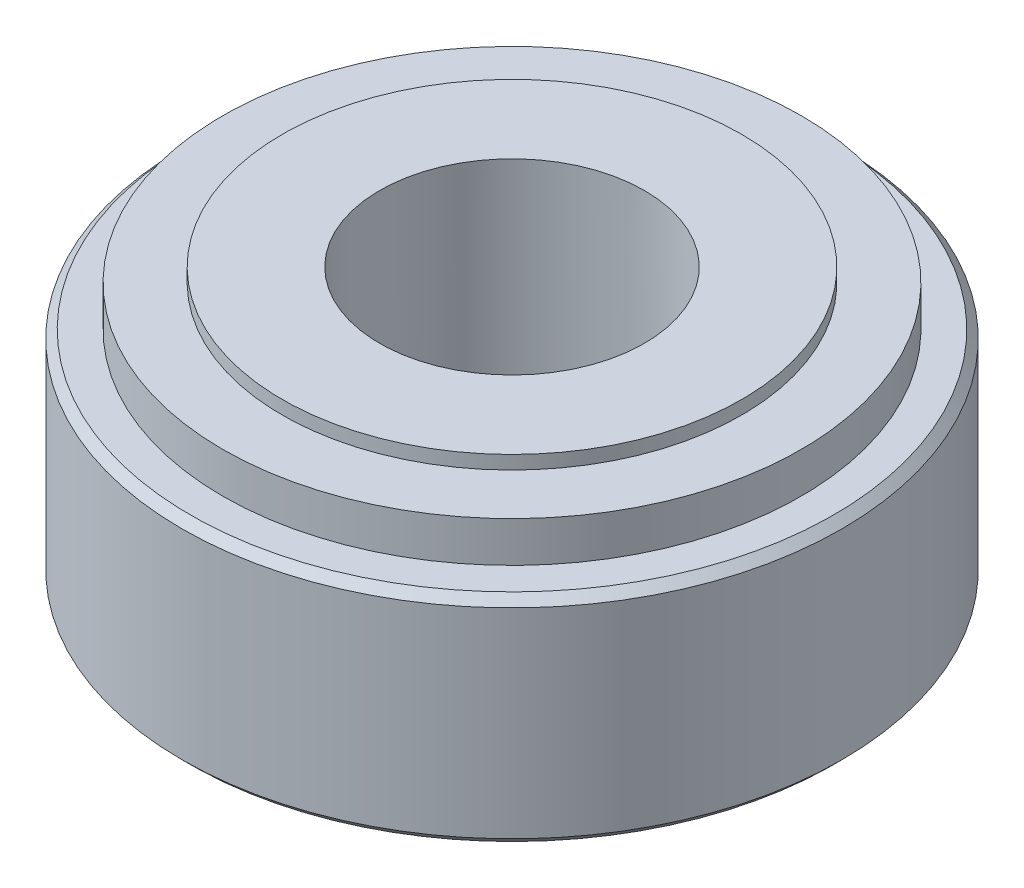
from build123d import *

# Parameters (mm, degrees)
SFAZOWANIE2_SIZE = 3


with BuildPart() as part:
    # Szkic1 → Obrót1 (revolve)
    with BuildSketch(Plane.XY, mode=Mode.PRIVATE) as obr_t1_sk:
        Polygon((-122, 69.81557254), (-122, -10.18442746), (-50.745506493, -10.18442746), (-49, 89.81557254), (-85, 89.81557254), (-85, 84.81557254), (-107, 84.81557254), (-107, 69.81557254), align=None)
    revolve(obr_t1_sk.sketch.rotate(Axis((0, 0, 0), (0, 1, 0)), 270), axis=Axis((0, 0, 0), (0, 1, 0)))

    # Sfazowanie2
    sfazowanie2_edges = [part.edges().sort_by_distance(p)[0] for p in [
        (0, -10.18442746, 122),
        (0, 69.81557254, 122),
    ]]
    chamfer(sfazowanie2_edges, length=SFAZOWANIE2_SIZE)


solid = part.part
